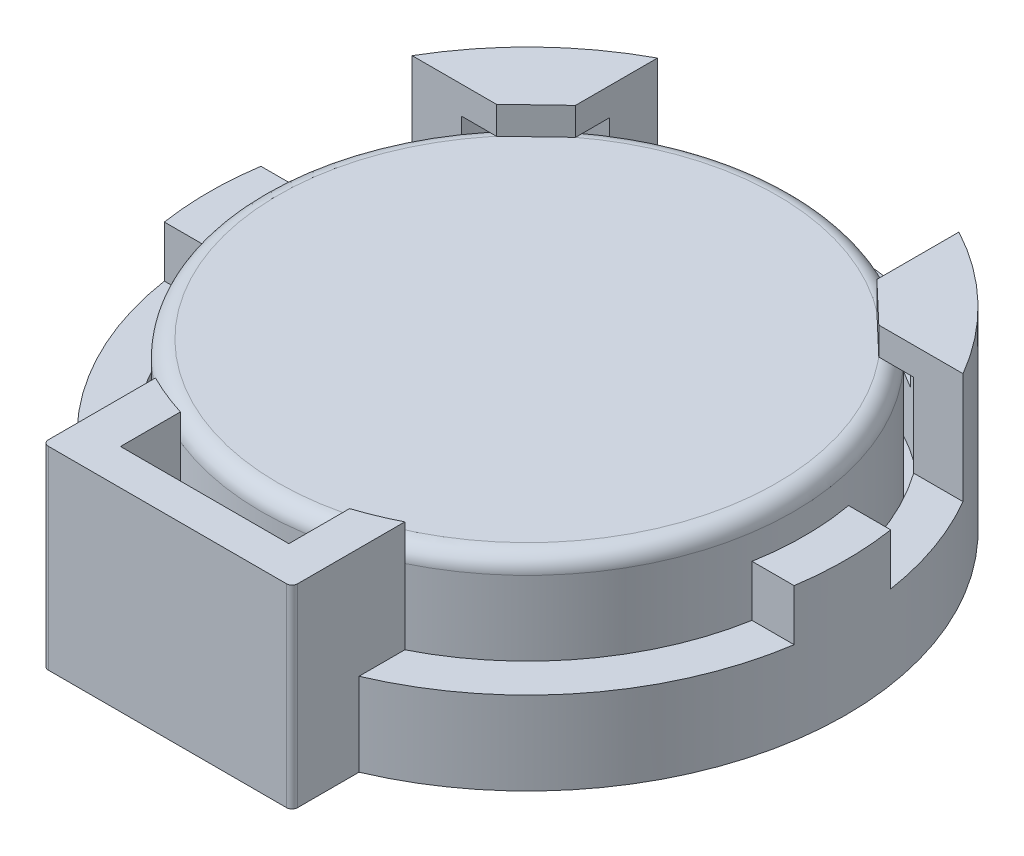
from build123d import *

# Parameters (mm, degrees)
CROQUIS1_R            = 11.5
EXTRUIR1_DEPTH        = 7
CROQUIS2_R            = 10
CORTAR_EXTRUIR1_DEPTH = 6
CROQUIS3_W            = 24.654500354
CROQUIS3_H            = 10.907748641
CORTAR_EXTRUIR2_DEPTH = 4
CROQUIS4_W            = 23.977576975
CROQUIS4_H            = 2.848058902
CORTAR_EXTRUIR3_DEPTH = 4
EXTRUIR2_DEPTH        = 4
EXTRUIR2_DEPTH_BACK   = 3
REDONDEO1_R           = 0.2
CROQUIS6_R            = 9.601083159
EXTRUIR3_DEPTH        = 5
REDONDEO2_R           = 0.6
EXTRUIR5_DEPTH        = 1
EXTRUIR5_2_DEPTH      = 1


with BuildPart() as part:
    # Croquis1 → Extruir1 (new body)
    with BuildSketch(Plane(origin=(0, 0, 0), x_dir=(1, 0, 0), z_dir=(0, 1, 0))):
        with Locations(Location((0, 0, 0), (0, 0, 270))):
            Circle(CROQUIS1_R)
    extrude(amount=EXTRUIR1_DEPTH)

    # Croquis2 → Cortar-Extruir1 (cut)
    with BuildSketch(Plane(origin=(0, 7, 0), x_dir=(-1, 0, 0), z_dir=(0, 1, 0))):
        with Locations(Location((0, 0, 0), (0, 0, 90))):
            Circle(CROQUIS2_R)
    extrude(amount=-CORTAR_EXTRUIR1_DEPTH, mode=Mode.SUBTRACT)

    # Croquis3 → Cortar-Extruir2 (cut)
    with BuildSketch(Plane(origin=(0, 7, 0), x_dir=(-1, 0, 0), z_dir=(0, 1, 0))):
        Polygon((-12.053311284, -1.7432475), (12.60118907, -1.7432475), (12.60118907, -5.778118356), (5.440306875, -5.778118356), (5.440306875, -12.650996141), (-5.440306875, -12.650996141), (-5.440306875, -5.778118356), (-12.053311284, -5.778118356), align=None)
        with Locations((0.273938893, 7.197121821)):
            Rectangle(CROQUIS3_W, CROQUIS3_H)
    extrude(amount=-CORTAR_EXTRUIR2_DEPTH, mode=Mode.SUBTRACT)

    # Croquis4 → Cortar-Extruir3 (cut)
    with BuildSketch(Plane.XY.offset(1.7432475)):
        with Locations((0.057730923, 6.271084337)):
            Rectangle(CROQUIS4_W, CROQUIS4_H)
    extrude(amount=-CORTAR_EXTRUIR3_DEPTH, mode=Mode.SUBTRACT)

    # Croquis5 → Extruir2 (add, two sides: drawn at the far end of the back side and taken through both)
    with BuildSketch(Plane(origin=(0, 3, 0), x_dir=(-1, 0, 0), z_dir=(0, 1, 0)).offset(-EXTRUIR2_DEPTH_BACK)):
        with BuildLine():
            Line((-4.5, 8.93028555), (-4.5, 13))
            Line((-4.5, 13), (4.5, 13))
            Line((4.5, 13), (4.5, 8.93028555))
            ThreePointArc((4.5, 8.93028555), (3.756725553, 9.267524649), (2.988424285, 9.543024693))
            Line((2.988424285, 9.543024693), (2.988424285, 11.704661784))
            Line((2.988424285, 11.704661784), (-3.088038428, 11.704661784))
            Line((-3.088038428, 11.704661784), (-3.088038428, 9.51125747))
            ThreePointArc((-3.088038428, 9.51125747), (-3.805123374, 9.247758437), (-4.5, 8.93028555))
        make_face()
    extrude(amount=EXTRUIR2_DEPTH + EXTRUIR2_DEPTH_BACK)

    # Redondeo1
    redondeo1_edges = [part.edges().sort_by_distance(p)[0] for p in [
        (4.5, 3.5, 13),
        (-4.5, 3.5, 13),
    ]]
    fillet(redondeo1_edges, radius=REDONDEO1_R)


with BuildPart() as body_2:
    # Croquis6 → Extruir3 (new body)
    with BuildSketch(Plane(origin=(0, 1, 0), x_dir=(-1, 0, 0), z_dir=(0, 1, 0))):
        with Locations(Location((0, 0, 0), (0, 0, 90))):
            Circle(CROQUIS6_R)
    extrude(amount=EXTRUIR3_DEPTH)

    # Redondeo2
    redondeo2_edges = [body_2.edges().sort_by_distance(p)[0] for p in [
        (0, 6, -9.601083159),
    ]]
    fillet(redondeo2_edges, radius=REDONDEO2_R)


with BuildPart() as body_3:
    # Croquis7 → Extruir5 (new body)
    with BuildSketch(Plane(origin=(0, 7, 0), x_dir=(-1, 0, 0), z_dir=(0, 1, 0))):
        with BuildLine():
            Line((-5.440306875, -8.390653199), (-5.440306875, -7.170952457))
            Line((-5.440306875, -7.170952457), (-6.90165533, -5.778118356))
            Line((-6.90165533, -5.778118356), (-8.161700084, -5.778118356))
            ThreePointArc((-8.161700084, -5.778118356), (-6.925314643, -7.213876704), (-5.440306875, -8.390653199))
        make_face()
    extrude(amount=-EXTRUIR5_DEPTH)


with BuildPart() as body_4:
    # Croquis7 → Extruir5 2 (new body)
    with BuildSketch(Plane(origin=(0, 7, 0), x_dir=(-1, 0, 0), z_dir=(0, 1, 0))):
        with BuildLine():
            Line((6.90165533, -5.778118356), (5.440306875, -7.170952457))
            Line((5.440306875, -7.170952457), (5.440306875, -8.390653199))
            ThreePointArc((5.440306875, -8.390653199), (6.925314643, -7.213876704), (8.161700084, -5.778118356))
            Line((8.161700084, -5.778118356), (6.90165533, -5.778118356))
        make_face()
    extrude(amount=-EXTRUIR5_2_DEPTH)


with BuildPart() as part_1:
    add(part.part)

    # Combinar1: union body 4, body 3
    add(body_4.part)
    add(body_3.part)


solid = Compound([body_2.part, part_1.part])
